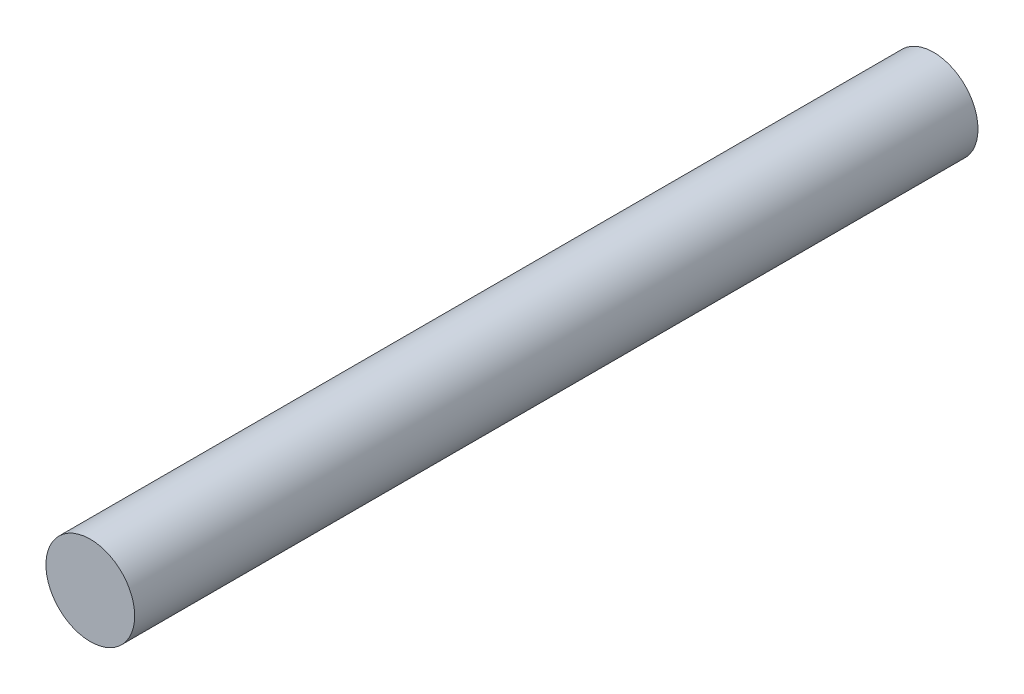
from build123d import *

# Parameters (mm, degrees)
SKETCH1_R           = 2
BOSS_EXTRUDE1_DEPTH = 38


with BuildPart() as part:
    # Sketch1 → Boss-Extrude1 (new body)
    with BuildSketch(Plane.XY):
        Circle(SKETCH1_R)
    extrude(amount=BOSS_EXTRUDE1_DEPTH)


solid = part.part
